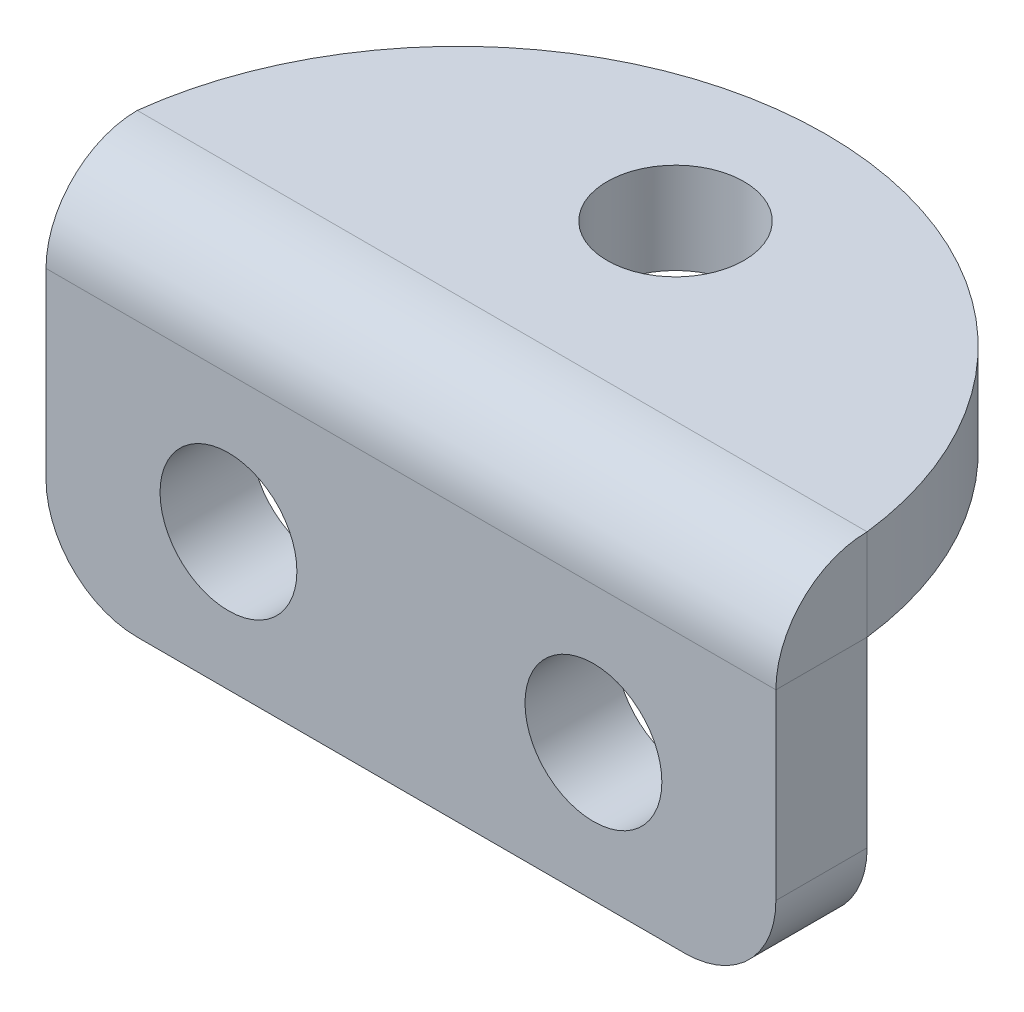
from build123d import *

# Parameters (mm, degrees)
BOSS_EXTRUDE1_DEPTH = 2
BOSS_EXTRUDE2_DEPTH = 2
SKETCH10_R          = 1.5
CUT_EXTRUDE3_DEPTH  = 6
CUT_EXTRUDE4_DEPTH  = 16
SKETCH12_R          = 1.5
CUT_EXTRUDE5_DEPTH  = 16


with BuildPart() as part:
    # Sketch1 → Boss-Extrude1 (new body)
    with BuildSketch(Plane.XY):
        with BuildLine():
            Line((0, 0), (0, -4))
            ThreePointArc((0, -4), (0.585786438, -5.414213562), (2, -6))
            Line((2, -6), (14, -6))
            ThreePointArc((14, -6), (15.414213562, -5.414213562), (16, -4))
            Line((16, -4), (16, 0))
            Line((16, 0), (0, 0))
        make_face()
    extrude(amount=BOSS_EXTRUDE1_DEPTH)

    # Sketch10 → Cut-Extrude3 (cut)
    with BuildSketch(Plane(origin=(0, 0, 0), x_dir=(-1, 0, 0), z_dir=(0, 0, -1))):
        with Locations((-12, -3)):
            Circle(SKETCH10_R)
        with Locations((-4, -3)):
            Circle(SKETCH10_R)
    extrude(amount=-CUT_EXTRUDE3_DEPTH, mode=Mode.SUBTRACT)


with BuildPart() as body_2:
    # Sketch5 → Boss-Extrude2 (new body)
    with BuildSketch(Plane(origin=(0, 0, 0), x_dir=(1, 0, 0), z_dir=(0, 1, 0))):
        with BuildLine():
            Line((0, 0), (0, -2))
            Line((0, -2), (16, -2))
            Line((16, -2), (16, 0))
            ThreePointArc((16, 0), (8, 7.097527245), (0, 0))
        make_face()
    extrude(amount=BOSS_EXTRUDE2_DEPTH)

    # Sketch11 → Cut-Extrude4 (cut)
    with BuildSketch(Plane(origin=(0, 0, 0), x_dir=(0, 0, -1), z_dir=(1, 0, 0))):
        with BuildLine():
            Line((0, 2), (-2, 2))
            Line((-2, 2), (-2, 0))
            ThreePointArc((-2, 0), (-1.414213562, 1.414213562), (0, 2))
        make_face()
    extrude(amount=CUT_EXTRUDE4_DEPTH, mode=Mode.SUBTRACT)

    # Sketch12 → Cut-Extrude5 (cut)
    with BuildSketch(Plane(origin=(0, 0, 0), x_dir=(1, 0, 0), z_dir=(0, 1, 0))):
        with Locations((8, 3.8)):
            Circle(SKETCH12_R)
    extrude(amount=CUT_EXTRUDE5_DEPTH, mode=Mode.SUBTRACT)


solid = Compound([part.part, body_2.part])
